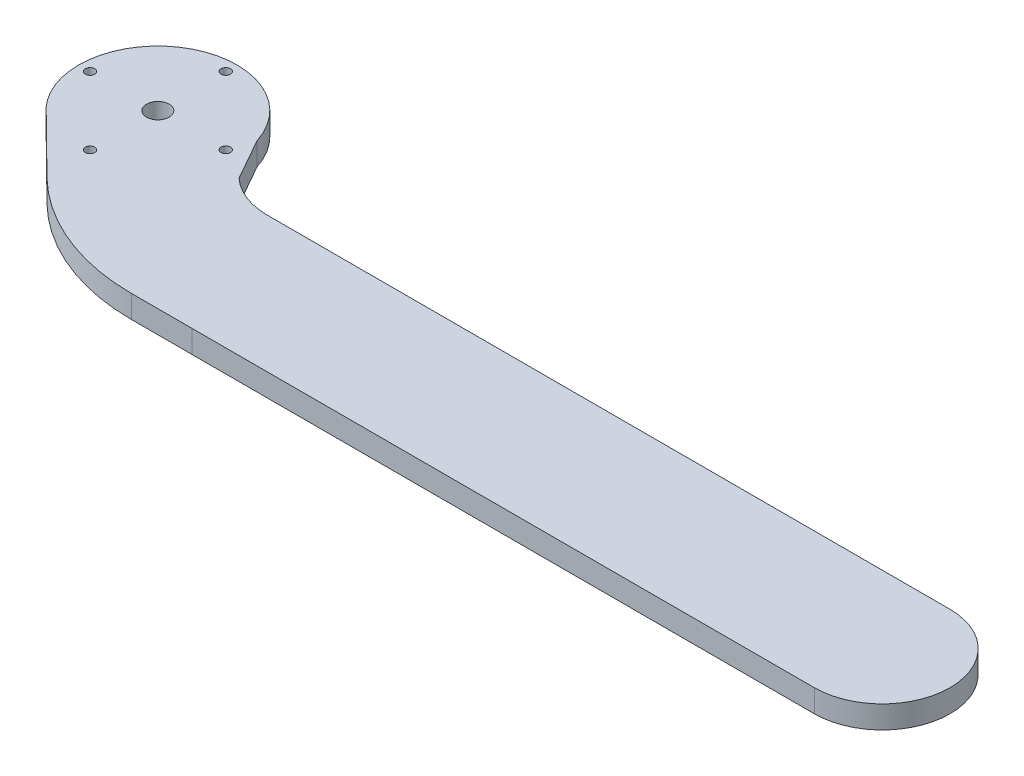
from build123d import *

# Parameters (mm, degrees)
BOSS_EXTRUDE1_DEPTH = 10
SKETCH3_R           = 5
SKETCH3_R_2         = 2.1
CUT_EXTRUDE1_DEPTH  = 10


with BuildPart() as part:
    # Sketch2 → Boss-Extrude1 (new body)
    with BuildSketch(Plane(origin=(0, 0, 0), x_dir=(1, 0, 0), z_dir=(0, 1, 0))):
        with BuildLine():
            Line((-224.228087349, 94.161183877), (85.275800554, 94.161183877))
            ThreePointArc((85.275800554, 94.161183877), (115.275800554, 64.161183877), (85.275800554, 34.161183877))
            Line((85.275800554, 34.161183877), (-189.724199446, 34.161183877))
            Line((-189.724199446, 34.161183877), (-216.678540206, 34.162870649))
            ThreePointArc((-216.678540206, 34.162870649), (-250.480097378, 40.753794505), (-279.331674578, 59.557305814))
            Line((-279.331674578, 59.557305814), (-303.368494474, 83.28636858))
            ThreePointArc((-303.368494474, 83.28636858), (-300.074671731, 139.135756578), (-247.333786879, 120.470214177))
            Line((-247.333786879, 120.470214177), (-236.884563066, 101.993319193))
            ThreePointArc((-236.884563066, 101.993319193), (-227.511529016, 96.189234726), (-216.67478541, 94.162870531))
            Line((-216.67478541, 94.162870531), (-224.228087349, 94.161183877))
        make_face()
    extrude(amount=BOSS_EXTRUDE1_DEPTH)

    # Sketch3 → Cut-Extrude1 (cut)
    with BuildSketch(Plane(origin=(0, 10, 0), x_dir=(1, 0, 0), z_dir=(0, 1, 0))):
        with Locations(Location((-280.722408111, 109.972596722, 0), (0, 0, 270))):
            Circle(SKETCH3_R)
        with Locations(Location((-280.722408111, 139.972596722, 0), (0, 0, 270))):
            Circle(SKETCH3_R_2)
        with Locations(Location((-310.722408111, 109.972596722, 0), (0, 0, 270))):
            Circle(SKETCH3_R_2)
        with Locations(Location((-280.722408111, 79.972596722, 0), (0, 0, 270))):
            Circle(SKETCH3_R_2)
        with Locations(Location((-250.722408111, 109.972596722, 0), (0, 0, 270))):
            Circle(SKETCH3_R_2)
    extrude(amount=-CUT_EXTRUDE1_DEPTH, mode=Mode.SUBTRACT)


solid = part.part
